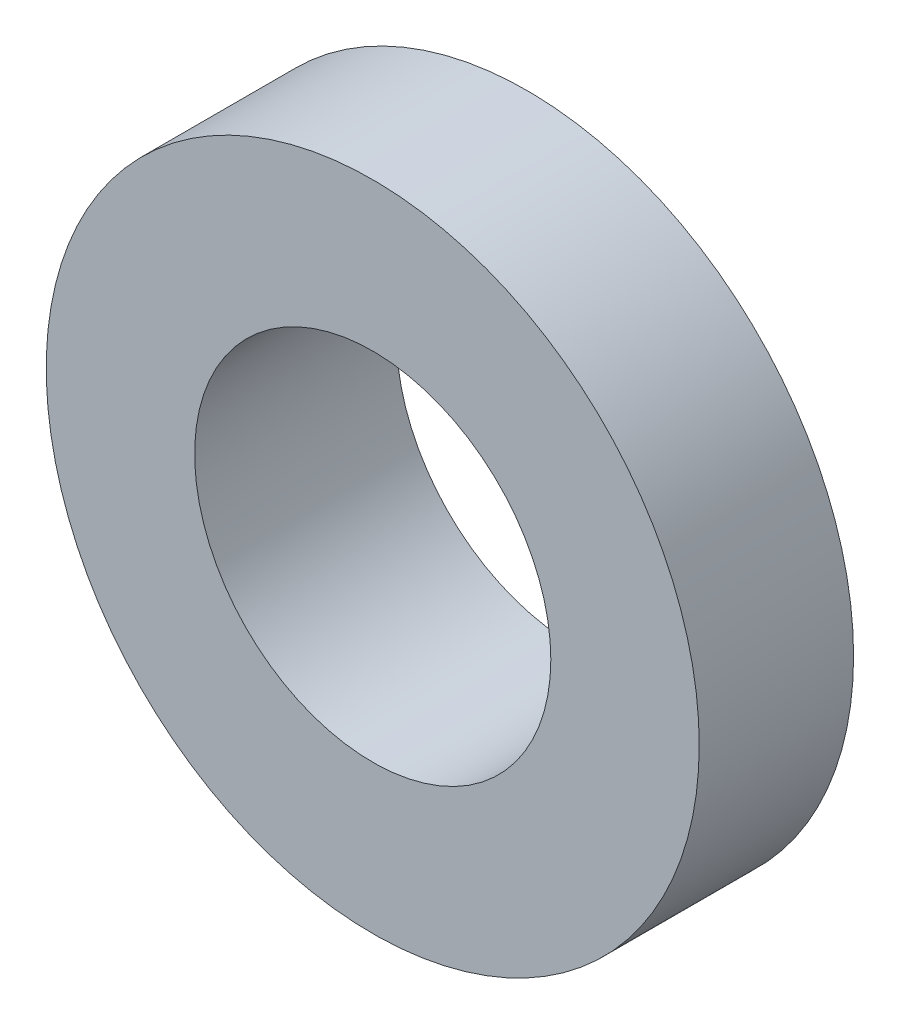
from build123d import *


with BuildPart() as part:
    # Sketch1 → REV_32006X_Envelope_cone_back_at_z0 (revolve)
    with BuildSketch(Plane(origin=(0, 0, 0), x_dir=(1, 0, 0), z_dir=(0, 1, 0))):
        Polygon((15, 0), (19.5, 0), (23.5, -4), (27.5, -4), (27.5, -17), (15, -17), align=None)
    revolve(axis=Axis((0, 0, 150), (0, 0, -1)))


solid = part.part
